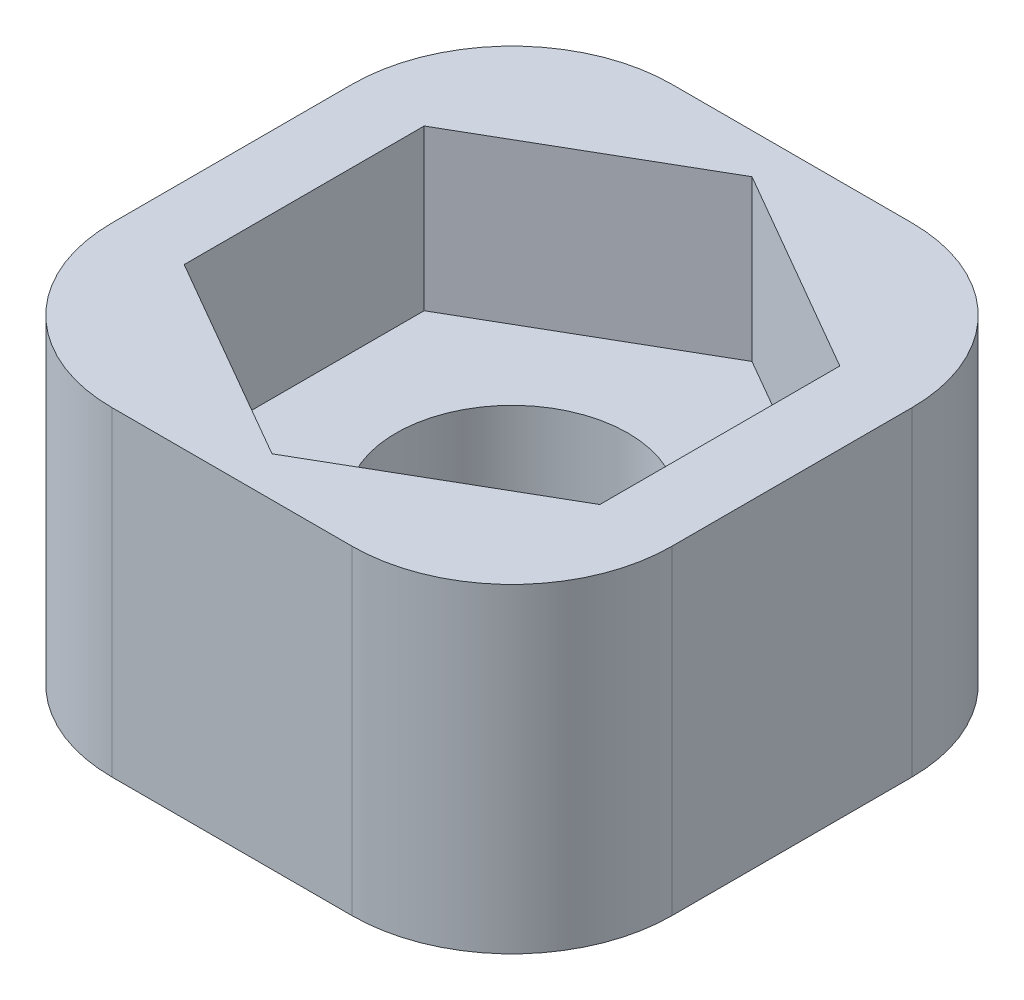
from build123d import *

# Parameters (mm, degrees)
SKETCH1_W           = 7
SKETCH1_H           = 7
BOSS_EXTRUDE1_DEPTH = 4
CUT_EXTRUDE1_DEPTH  = 2
SKETCH4_R           = 1.45
CUT_EXTRUDE2_DEPTH  = 2
FILLET1_R           = 2


with BuildPart() as part:
    # Sketch1 → Boss-Extrude1 (new body)
    with BuildSketch(Plane(origin=(0, 0, 0), x_dir=(1, 0, 0), z_dir=(0, 1, 0))):
        Rectangle(SKETCH1_W, SKETCH1_H)
    extrude(amount=BOSS_EXTRUDE1_DEPTH)

    # Sketch2 → Cut-Extrude1 (cut)
    with BuildSketch(Plane(origin=(0, 4, 0), x_dir=(1, 0, 0), z_dir=(0, 1, 0))):
        Polygon((2.598076211, -1.5), (2.598076211, 1.5), (0, 3), (-2.598076211, 1.5), (-2.598076211, -1.5), (0, -3), align=None)
    extrude(amount=-CUT_EXTRUDE1_DEPTH, mode=Mode.SUBTRACT)

    # Sketch4 → Cut-Extrude2 (cut)
    with BuildSketch(Plane(origin=(0, 2, 0), x_dir=(1, 0, 0), z_dir=(0, 1, 0))):
        with Locations(Location((0, 0, 0), (0, 0, 270))):
            Circle(SKETCH4_R)
    extrude(amount=-CUT_EXTRUDE2_DEPTH, mode=Mode.SUBTRACT)

    # Fillet1
    fillet1_edges = [part.edges().sort_by_distance(p)[0] for p in [
        (3.5, 2, 3.5),
        (-3.5, 2, 3.5),
        (-3.5, 2, -3.5),
        (3.5, 2, -3.5),
    ]]
    fillet(fillet1_edges, radius=FILLET1_R)


solid = part.part
